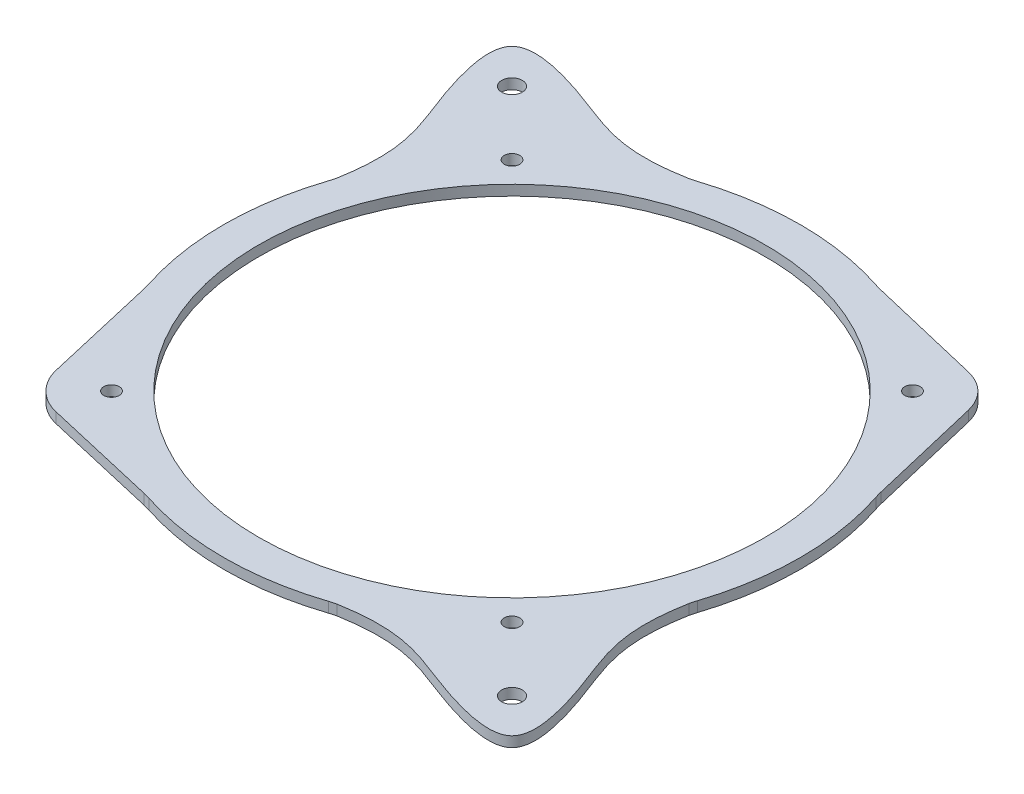
from build123d import *

# Parameters (mm, degrees)
SKETCH1_R           = 1.5
SKETCH1_R_2         = 49.2
BOSS_EXTRUDE1_DEPTH = 2
SKETCH2_R           = 2
CUT_EXTRUDE1_DEPTH  = 84.538877218


with BuildPart() as part:
    # Sketch1 → Boss-Extrude1 (new body)
    with BuildSketch(Plane(origin=(0, 0, 0), x_dir=(1, 0, 0), z_dir=(0, 1, 0))):
        with BuildLine():
            Line((18.82031265, 52.821731984), (41.072517471, 47.543215273))
            ThreePointArc((41.072517471, 47.543215273), (43.317509083, 46.680398122), (45.253835365, 45.253835365))
            ThreePointArc((45.253835365, 45.253835365), (46.680398122, 43.317509083), (47.543215273, 41.072517471))
            Line((47.543215273, 41.072517471), (52.821731984, 18.82031265))
            ThreePointArc((52.821731984, 18.82031265), (52.992929389, 18.161367335), (53.192004456, 17.510301595))
            ThreePointArc((53.192004456, 17.510301595), (55.281581077, 8.941297091), (55.999797799, 0.150487493))
            ThreePointArc((55.999797799, 0.150487493), (55.328837954, -8.644055219), (53.285345919, -17.224166462))
            ThreePointArc((53.285345919, -17.224166462), (53.089772901, -17.876292734), (52.922119493, -18.536148639))
            add(Edge.make_bspline(
                [(52.922119493, -18.536148639), (50.275210127, -33.089832281), (56.508752557, -38.252381664), (60.591514669, -60.591343739), (38.37255444, -56.530788224), (33.171934015, -50.362758483), (18.82031265, -52.821731984)],
                knots=[0, 0, 0, 0, 0.378239646, 0.501703935, 0.625168225, 1, 1, 1, 1], degree=3))
            ThreePointArc((18.82031265, -52.821731984), (18.161367335, -52.992929389), (17.510301595, -53.192004456))
            ThreePointArc((17.510301595, -53.192004456), (0.150487493, -55.999797799), (-17.224166462, -53.285345919))
            ThreePointArc((-17.224166462, -53.285345919), (-17.876292734, -53.089772901), (-18.536148639, -52.922119493))
            Line((-18.536148639, -52.922119493), (-40.816401641, -47.763274249))
            ThreePointArc((-40.816401641, -47.763274249), (-43.21650894, -46.829307007), (-45.253835365, -45.253835365))
            ThreePointArc((-45.253835365, -45.253835365), (-46.829307007, -43.21650894), (-47.763274249, -40.816401641))
            Line((-47.763274249, -40.816401641), (-52.922119493, -18.536148639))
            ThreePointArc((-52.922119493, -18.536148639), (-53.089772901, -17.876292734), (-53.285345919, -17.224166462))
            ThreePointArc((-53.285345919, -17.224166462), (-55.999797799, 0.150487493), (-53.192004456, 17.510301595))
            ThreePointArc((-53.192004456, 17.510301595), (-52.992929389, 18.161367335), (-52.821731984, 18.82031265))
            add(Edge.make_bspline(
                [(-18.536148639, 52.922119493), (-33.089832281, 50.275210127), (-38.252381664, 56.508752557), (-60.591343739, 60.591514669), (-56.530788224, 38.37255444), (-50.362758483, 33.171934015), (-52.821731984, 18.82031265)],
                knots=[0, 0, 0, 0, 0.378239646, 0.501703935, 0.625168225, 1, 1, 1, 1], degree=3))
            Line((-18.536148639, 52.922119493), (-17.224166462, 53.285345919))
            ThreePointArc((-17.224166462, 53.285345919), (-8.644055219, 55.328837954), (0.150487493, 55.999797799))
            ThreePointArc((0.150487493, 55.999797799), (8.941297091, 55.281581077), (17.510301595, 53.192004456))
            ThreePointArc((17.510301595, 53.192004456), (18.161367335, 52.992929389), (18.82031265, 52.821731984))
        make_face()
        with Locations(Location((-38.8907, 38.8907, 0), (0, 0, 270))):
            Circle(SKETCH1_R, mode=Mode.SUBTRACT)
        with Locations(Location((38.8907, 38.8907, 0), (0, 0, 90))):
            Circle(SKETCH1_R, mode=Mode.SUBTRACT)
        with Locations(Location((38.8907, -38.8907, 0), (0, 0, 270))):
            Circle(SKETCH1_R, mode=Mode.SUBTRACT)
        with Locations(Location((-38.8907, -38.8907, 0), (0, 0, 90))):
            Circle(SKETCH1_R, mode=Mode.SUBTRACT)
        with Locations(Location((0, 0, 0), (0, 0, 270))):
            Circle(SKETCH1_R_2, mode=Mode.SUBTRACT)
    extrude(amount=BOSS_EXTRUDE1_DEPTH)

    # Sketch2 → Cut-Extrude1 (cut, through all)
    with BuildSketch(Plane(origin=(0, 2, 0), x_dir=(1, 0, 0), z_dir=(0, 1, 0))):
        with Locations(Location((-51.265241636, 51.265241636, 0), (0, 0, 270))):
            Circle(SKETCH2_R)
        with Locations(Location((51.265241636, -51.265241636, 0), (0, 0, 90))):
            Circle(SKETCH2_R)
    extrude(amount=-CUT_EXTRUDE1_DEPTH, mode=Mode.SUBTRACT)


solid = part.part
